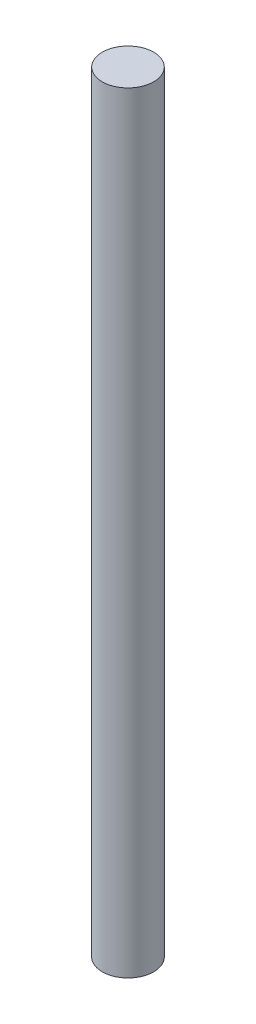
from build123d import *

# Parameters (mm, degrees)
IZIM2_R                     = 5
Y_KSEKLIK_EKSTR_ZYON1_DEPTH = 150


with BuildPart() as part:
    # Çizim2 → Yükseklik-Ekstrüzyon1 (new body)
    with BuildSketch(Plane(origin=(0, 0, 0), x_dir=(1, 0, 0), z_dir=(0, 1, 0))):
        with Locations(Location((0, 0, 0), (0, 0, 270))):
            Circle(IZIM2_R)
    extrude(amount=Y_KSEKLIK_EKSTR_ZYON1_DEPTH)


solid = part.part
